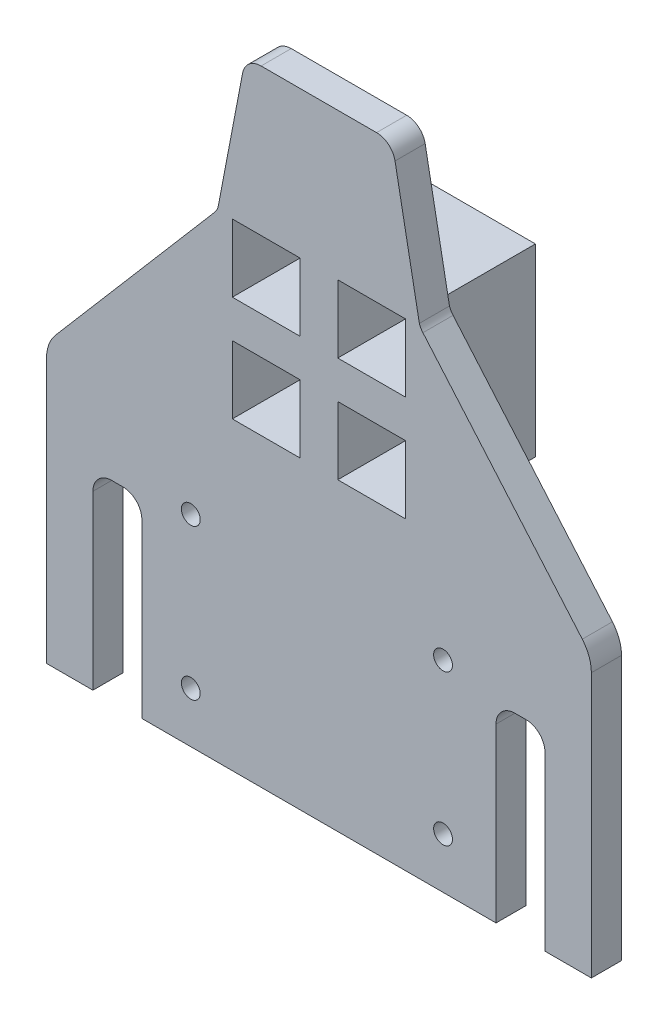
from build123d import *

# Parameters (mm, degrees)
BOSS_EXTRUDE1_DEPTH    = 8
SPLIT1_SURFACE_1_BACK  = 343.199
SPLIT1_SURFACE_1_DEPTH = 686.398
SPLIT1_SURFACE_2_BACK  = 343.199
SPLIT1_SURFACE_2_DEPTH = 686.398
SKETCH5_R              = 2.5
CUT_EXTRUDE6_DEPTH     = 5.2
SKETCH4_R              = 2.5
CUT_EXTRUDE7_DEPTH     = 10
SKETCH6_R              = 1.5
CUT_EXTRUDE8_DEPTH     = 342.206659287
SKETCH7_W              = 49
SKETCH7_H              = 49
SKETCH7_W_2            = 18
SKETCH7_H_2            = 18
BOSS_EXTRUDE2_DEPTH    = 15
SKETCH8_W              = 49
SKETCH8_H              = 49
SKETCH8_R              = 1.5
BOSS_EXTRUDE3_DEPTH    = 10
SKETCH9_W              = 49
SKETCH9_H              = 49
CUT_EXTRUDE9_DEPTH     = 8
SKETCH10_W             = 49
SKETCH10_H             = 49
SKETCH10_W_2           = 18
SKETCH10_H_2           = 18
BOSS_EXTRUDE4_DEPTH    = 8
SKETCH12_R             = 2.5
CUT_EXTRUDE10_DEPTH    = 343.027753759


with BuildPart() as part:
    # Sketch1 → Boss-Extrude1 (new body)
    with BuildSketch(Plane.XY):
        with BuildLine():
            Line((70, 309.985818768), (85.299227191, 309.985818768))
            ThreePointArc((85.299227191, 309.985818768), (88.489017574, 308.836174247), (90.211957942, 305.915913694))
            Line((90.211957942, 305.915913694), (96.672728921, 271.790334282))
            ThreePointArc((96.672728921, 271.790334282), (97.06575438, 270.906904614), (97.621470019, 270.115641625))
            Line((97.621470019, 270.115641625), (139.950460317, 220.786053348))
            ThreePointArc((139.950460317, 220.786053348), (141.739336996, 217.746026552), (142.361429131, 214.274017901))
            Line((142.361429131, 214.274017901), (142.361429131, 30.859943174))
            ThreePointArc((142.361429131, 30.859943174), (140.896963037, 27.324409268), (137.361429131, 25.859943174))
            Line((137.361429131, 25.859943174), (114.717190871, 25.782318449))
            ThreePointArc((114.717190871, 25.782318449), (112.681998989, 25.341726514), (111.002773989, 24.110332733))
            Line((111.002773989, 24.110332733), (89.38285929, 0))
            Line((89.38285929, 0), (50.5, 0))
            Line((50.5, 0), (28.997226011, 24.110332733))
            ThreePointArc((28.997226011, 24.110332733), (27.318001011, 25.341726514), (25.282809129, 25.782318449))
            Line((25.282809129, 25.782318449), (2.638570869, 25.859943174))
            ThreePointArc((2.638570869, 25.859943174), (-0.896963037, 27.324409268), (-2.361429131, 30.859943174))
            Line((-2.361429131, 30.859943174), (-2.361429131, 214.274017901))
            ThreePointArc((-2.361429131, 214.274017901), (-1.739336996, 217.746026552), (0.049539683, 220.786053348))
            Line((0.049539683, 220.786053348), (42.261389271, 270.115641625))
            ThreePointArc((42.261389271, 270.115641625), (42.81710491, 270.906904614), (43.210130369, 271.790334282))
            Line((43.210130369, 271.790334282), (49.724618218, 305.923183314))
            ThreePointArc((49.724618218, 305.923183314), (51.449026762, 308.838533573), (54.635967087, 309.985818768))
            Line((54.635967087, 309.985818768), (70, 309.985818768))
        make_face()
        with BuildLine():
            Line((15.218798766, 54.807228462), (17.702103505, 54.807228462))
            ThreePointArc((17.702103505, 54.807228462), (21.420312934, 56.347361236), (22.960445707, 60.065570665))
            Line((22.960445707, 60.065570665), (22.960445707, 189.807228462))
            ThreePointArc((22.960445707, 189.807228462), (21.495979613, 193.342762368), (17.960445707, 194.807228462))
            Line((17.960445707, 194.807228462), (14.960456564, 194.807228462))
            ThreePointArc((14.960456564, 194.807228462), (11.424922658, 193.342762368), (9.960456564, 189.807228462))
            Line((9.960456564, 189.807228462), (9.960456564, 60.065570665))
            ThreePointArc((9.960456564, 60.065570665), (11.500589337, 56.347361236), (15.218798766, 54.807228462))
        make_face(mode=Mode.SUBTRACT)
        with BuildLine():
            Line((125.039543436, 54.807228462), (122.039554293, 54.807228462))
            ThreePointArc((122.039554293, 54.807228462), (118.504020387, 56.271694556), (117.039554293, 59.807228462))
            Line((117.039554293, 59.807228462), (117.039554293, 189.807228462))
            ThreePointArc((117.039554293, 189.807228462), (118.504020387, 193.342762368), (122.039554293, 194.807228462))
            Line((122.039554293, 194.807228462), (125.039543436, 194.807228462))
            ThreePointArc((125.039543436, 194.807228462), (128.575077342, 193.342762368), (130.039543436, 189.807228462))
            Line((130.039543436, 189.807228462), (130.039543436, 59.807228462))
            ThreePointArc((130.039543436, 59.807228462), (128.575077342, 56.271694556), (125.039543436, 54.807228462))
        make_face(mode=Mode.SUBTRACT)
    extrude(amount=BOSS_EXTRUDE1_DEPTH)


with BuildPart() as body_2:
    # Split1: the piece behind the surface
    add(part.part)
    # Split1 surface: a surface, the sketch's curves swept straight by 686.398 mm
    with BuildLine(Plane(origin=(0, 0, 0), x_dir=(-1, 0, 0), z_dir=(0, 0, -1)).offset(-SPLIT1_SURFACE_1_BACK), mode=Mode.PRIVATE) as split1_surface_1_path:
        Line((-142.361429131, 144.05225917), (2.361429131, 144.05225917))
    split1_surface_1 = Shell.extrude(split1_surface_1_path.wire(), (0 * SPLIT1_SURFACE_1_DEPTH, 0 * SPLIT1_SURFACE_1_DEPTH, -1 * SPLIT1_SURFACE_1_DEPTH))
    split(bisect_by=split1_surface_1, keep=Keep.BOTTOM)

    # Sketch5 → Cut-Extrude6 (cut)
    with BuildSketch(Plane(origin=(0, 144.05225917, -115.359943174), x_dir=(1, 0, 0), z_dir=(0, -1, 0))):
        with Locations(Location((70, 119.359943174, 0), (0, 0, 270))):
            Circle(SKETCH5_R)
        with Locations(Location((40, 119.359943174, 0), (0, 0, 270))):
            Circle(SKETCH5_R)
        with Locations(Location((2.638570869, 119.359943174, 0), (0, 0, 270))):
            Circle(SKETCH5_R)
    extrude(amount=CUT_EXTRUDE6_DEPTH, mode=Mode.SUBTRACT)


with BuildPart() as part_1:
    add(part.part)

    # Split1: split by a surface, the side it looks to stays
    # Split1 surface: a surface, the sketch's curves swept straight by 686.398 mm
    with BuildLine(Plane(origin=(0, 0, 0), x_dir=(-1, 0, 0), z_dir=(0, 0, -1)).offset(-SPLIT1_SURFACE_2_BACK), mode=Mode.PRIVATE) as split1_surface_2_path:
        Line((-142.361429131, 144.05225917), (2.361429131, 144.05225917))
    split1_surface_2 = Shell.extrude(split1_surface_2_path.wire(), (0 * SPLIT1_SURFACE_2_DEPTH, 0 * SPLIT1_SURFACE_2_DEPTH, -1 * SPLIT1_SURFACE_2_DEPTH))
    split(bisect_by=split1_surface_2, keep=Keep.TOP)

    # Sketch4 → Cut-Extrude7 (cut)
    with BuildSketch(Plane(origin=(0, 144.05225917, 0), x_dir=(-1, 0, 0), z_dir=(0, -1, 0))):
        with Locations(Location((-70, -4, 0), (0, 0, 270))):
            Circle(SKETCH4_R)
        with Locations(Location((-40, -4, 0), (0, 0, 270))):
            Circle(SKETCH4_R)
        with Locations(Location((-100, -4, 0), (0, 0, 270))):
            Circle(SKETCH4_R)
        with Locations(Location((-137.361429131, -4, 0), (0, 0, 90))):
            Circle(SKETCH4_R)
        with Locations(Location((-3.799513716, -4, 0), (0, 0, 270))):
            Circle(SKETCH4_R)
    extrude(amount=-CUT_EXTRUDE7_DEPTH, mode=Mode.SUBTRACT)

    # Sketch6 → Cut-Extrude8 (cut, through all)
    with BuildSketch(Plane.XY.offset(8)):
        with Locations((50.000130369, 267.980334282)):
            Circle(SKETCH6_R)
        with Locations((90.000130369, 267.980334282)):
            Circle(SKETCH6_R)
        with Locations((90.000130369, 227.980334282)):
            Circle(SKETCH6_R)
        with Locations((50.000130369, 227.980334282)):
            Circle(SKETCH6_R)
    extrude(amount=-CUT_EXTRUDE8_DEPTH, mode=Mode.SUBTRACT)

    # Sketch7 → Boss-Extrude2 (add)
    with BuildSketch(Plane(origin=(0, 0, 0), x_dir=(-1, 0, 0), z_dir=(0, 0, -1))):
        with Locations((-70.000130369, 247.980334282)):
            Rectangle(SKETCH7_W, SKETCH7_H)
        with Locations((-56.000130369, 261.980334282)):
            Rectangle(SKETCH7_W_2, SKETCH7_H_2, mode=Mode.SUBTRACT)
        with Locations((-84.000130369, 261.980334282)):
            Rectangle(SKETCH7_W_2, SKETCH7_H_2, mode=Mode.SUBTRACT)
        with Locations((-84.000130369, 233.980334282)):
            Rectangle(SKETCH7_W_2, SKETCH7_H_2, mode=Mode.SUBTRACT)
        with Locations((-56.000130369, 233.980334282)):
            Rectangle(SKETCH7_W_2, SKETCH7_H_2, mode=Mode.SUBTRACT)
    extrude(amount=BOSS_EXTRUDE2_DEPTH)

    # Sketch8 → Boss-Extrude3 (add)
    with BuildSketch(Plane(origin=(0, 0, -15), x_dir=(-1, 0, 0), z_dir=(0, 0, -1))):
        with Locations((-70.000130369, 247.980334282)):
            Rectangle(SKETCH8_W, SKETCH8_H)
        with Locations(Location((-50.000130369, 267.980334282, 0), (0, 0, 180))):
            Circle(SKETCH8_R, mode=Mode.SUBTRACT)
        with Locations(Location((-90.000130369, 267.980334282, 0), (0, 0, 180))):
            Circle(SKETCH8_R, mode=Mode.SUBTRACT)
        with Locations(Location((-50.000130369, 227.980334282, 0), (0, 0, 180))):
            Circle(SKETCH8_R, mode=Mode.SUBTRACT)
        with Locations(Location((-90.000130369, 227.980334282, 0), (0, 0, 180))):
            Circle(SKETCH8_R, mode=Mode.SUBTRACT)
    extrude(amount=BOSS_EXTRUDE3_DEPTH)

    # Sketch9 → Cut-Extrude9 (cut)
    with BuildSketch(Plane.XY.offset(8)):
        with Locations((70.000130369, 247.980334282)):
            Rectangle(SKETCH9_W, SKETCH9_H)
    extrude(amount=-CUT_EXTRUDE9_DEPTH, mode=Mode.SUBTRACT)


with BuildPart() as cut_extrude9_piece_1:
    # of the separate pieces the step leaves, piece 1, a body of its own (cut_extrude9_pieces)
    add(part_1.part.solids().sort_by_distance((49.724618218, 305.923183314, 0))[0])



with BuildPart() as cut_extrude9_piece_2:
    # of the separate pieces the step leaves, piece 2, a body of its own (cut_extrude9_pieces)
    add(part_1.part.solids().sort_by_distance((45.500130369, 223.480334282, -25))[0])


with BuildPart() as cut_extrude9_piece_1_1:
    add(cut_extrude9_piece_1.part)

    add(cut_extrude9_piece_2.part)  # Boss-Extrude4 merges Cut-Extrude9 piece 2
    # Sketch10 → Boss-Extrude4 (add)
    with BuildSketch(Plane.XY):
        with Locations((70.000130369, 247.980334282)):
            Rectangle(SKETCH10_W, SKETCH10_H)
        with Locations((84.000130369, 261.980334282)):
            Rectangle(SKETCH10_W_2, SKETCH10_H_2, mode=Mode.SUBTRACT)
        with Locations((56.000130369, 261.980334282)):
            Rectangle(SKETCH10_W_2, SKETCH10_H_2, mode=Mode.SUBTRACT)
        with Locations((56.000130369, 233.980334282)):
            Rectangle(SKETCH10_W_2, SKETCH10_H_2, mode=Mode.SUBTRACT)
        with Locations((84.000130369, 233.980334282)):
            Rectangle(SKETCH10_W_2, SKETCH10_H_2, mode=Mode.SUBTRACT)
    extrude(amount=BOSS_EXTRUDE4_DEPTH)

    # Sketch12 → Cut-Extrude10 (cut, through all)
    with BuildSketch(Plane(origin=(0, 0, 0), x_dir=(-1, 0, 0), z_dir=(0, 0, -1))):
        with Locations((-102.960445707, 197.503395095)):
            Circle(SKETCH12_R)
        with Locations((-35.960445707, 197.503395095)):
            Circle(SKETCH12_R)
        with Locations((-35.960445707, 157.503395095)):
            Circle(SKETCH12_R)
        with Locations((-102.960445707, 157.503395095)):
            Circle(SKETCH12_R)
    extrude(amount=-CUT_EXTRUDE10_DEPTH, mode=Mode.SUBTRACT)


solid = cut_extrude9_piece_1_1.part
